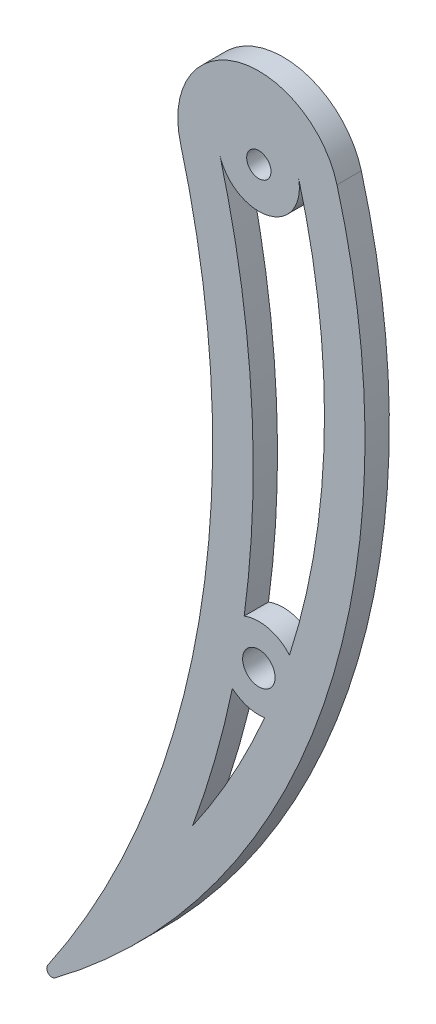
from build123d import *

# Parameters (mm, degrees)
SKETCH1_R           = 1.5
SKETCH1_R_2         = 2
EXTRUDE1_DEPTH      = 3
CUT_EXTRUDE1_DEPTH  = 10
BOSS_EXTRUDE1_DEPTH = 3
CUT_EXTRUDE2_DEPTH  = 5


with BuildPart() as part:
    # Sketch1 → Extrude1 (new body)
    with BuildSketch(Plane.XY):
        with BuildLine():
            ThreePointArc((-26.085308936, -49.243272897), (-24.983078735, -55.562467556), (-18.568566007, -55.596511855))
            ThreePointArc((-18.568566007, -55.596511855), (9.955092257, -6.447651038), (9.831223687, 50.378348795))
            ThreePointArc((9.831223687, 50.378348795), (4.259504767, 53.557286163), (0.144535316, 48.6362374))
            ThreePointArc((0.144535316, 48.6362374), (0.489229737, -3.910438591), (-26.085308936, -49.243272897))
        make_face()
        with BuildLine():
            ThreePointArc((4.144339435, -6.895700301), (3.212712938, -4.646015269), (5.144535316, -3.1637626))
            ThreePointArc((5.144535316, -3.1637626), (7.076357694, -5.681509932), (4.144339435, -6.895700301))
        make_face(mode=Mode.SUBTRACT)
        with Locations((5.144535316, 48.6362374)):
            Circle(SKETCH1_R, mode=Mode.SUBTRACT)
        with Locations((-21.755464684, -51.7437626)):
            Circle(SKETCH1_R_2, mode=Mode.SUBTRACT)
    extrude(amount=EXTRUDE1_DEPTH)

    # Sketch3 → Cut-Extrude1 (cut)
    with BuildSketch(Plane(origin=(0, 0, 0), x_dir=(-1, 0, 0), z_dir=(0, 0, -1))):
        with BuildLine():
            ThreePointArc((26.085308936, -49.243272897), (16.272417408, -38.139391171), (8.225333931, -25.696181093))
            ThreePointArc((8.225333931, -25.696181093), (13.854681069, -38.186869472), (20.909608136, -49.931436277))
            ThreePointArc((20.909608136, -49.931436277), (22.829775371, -50.05679593), (23.755464684, -51.7437626))
            ThreePointArc((23.755464684, -51.7437626), (21.27804664, -53.685944881), (19.983392673, -50.816529735))
            ThreePointArc((19.983392673, -50.816529735), (8.408185994, -40.542939738), (-1.362976888, -28.540588427))
            ThreePointArc((-1.362976888, -28.540588427), (7.552683596, -42.842145312), (18.568566007, -55.596511855))
            ThreePointArc((18.568566007, -55.596511855), (24.983078735, -55.562467556), (26.085308936, -49.243272897))
        make_face()
    extrude(amount=-CUT_EXTRUDE1_DEPTH, mode=Mode.SUBTRACT)

    # Sketch3<3> → Boss-Extrude1 (add)
    with BuildSketch(Plane(origin=(0, 0, 0), x_dir=(-1, 0, 0), z_dir=(0, 0, -1))):
        with BuildLine():
            ThreePointArc((8.225333931, -25.696181093), (0.709764151, 9.885397236), (4.515866122, 46.052317111))
            ThreePointArc((4.515866122, 46.052317111), (-2.521867284, 58.28619141), (-14.783886482, 51.297610936))
            ThreePointArc((-14.783886482, 51.297610936), (-16.914814846, 9.892262753), (-1.362976888, -28.540588427))
            ThreePointArc((-1.362976888, -28.540588427), (-13.044605865, 10.119739731), (-9.831223687, 50.378348795))
            ThreePointArc((-9.831223687, 50.378348795), (-4.259504767, 53.557286163), (-0.144535316, 48.6362374))
            ThreePointArc((-0.144535316, 48.6362374), (-3.243862831, 10.649816422), (8.225333931, -25.696181093))
        make_face()
        with BuildLine():
            ThreePointArc((19.983392673, -50.816529735), (20.822206397, -50.767144538), (20.909608136, -49.931436277))
            ThreePointArc((20.909608136, -49.931436277), (20.37371395, -50.297814846), (19.983392673, -50.816529735))
        make_face()
    extrude(amount=-BOSS_EXTRUDE1_DEPTH)

    # Sketch4 → Cut-Extrude2 (cut)
    with BuildSketch(Plane(origin=(0, 0, 0), x_dir=(-1, 0, 0), z_dir=(0, 0, -1))):
        with BuildLine():
            ThreePointArc((-1.879022525, -8.950109944), (-3.738208311, -9.961912697), (-5.849425706, -10.11382619))
            ThreePointArc((-5.849425706, -10.11382619), (-1.805817512, -18.34494551), (3.046878131, -26.126554438))
            ThreePointArc((3.046878131, -26.126554438), (0.268148473, -17.628892121), (-1.879022525, -8.950109944))
        make_face()
        with BuildLine():
            ThreePointArc((-9.964210899, 49.966924168), (-13.222981584, 23.962412042), (-8.924214856, -1.890534442))
            ThreePointArc((-8.924214856, -1.890534442), (-6.34883687, -0.310963638), (-3.333762814, -0.503172193))
            ThreePointArc((-3.333762814, -0.503172193), (-4.204319589, 23.570760268), (-0.314334597, 47.344277255))
            ThreePointArc((-0.314334597, 47.344277255), (-6.455869332, 43.811260395), (-9.964210899, 49.966924168))
        make_face()
    extrude(amount=-CUT_EXTRUDE2_DEPTH, mode=Mode.SUBTRACT)


solid = part.part
